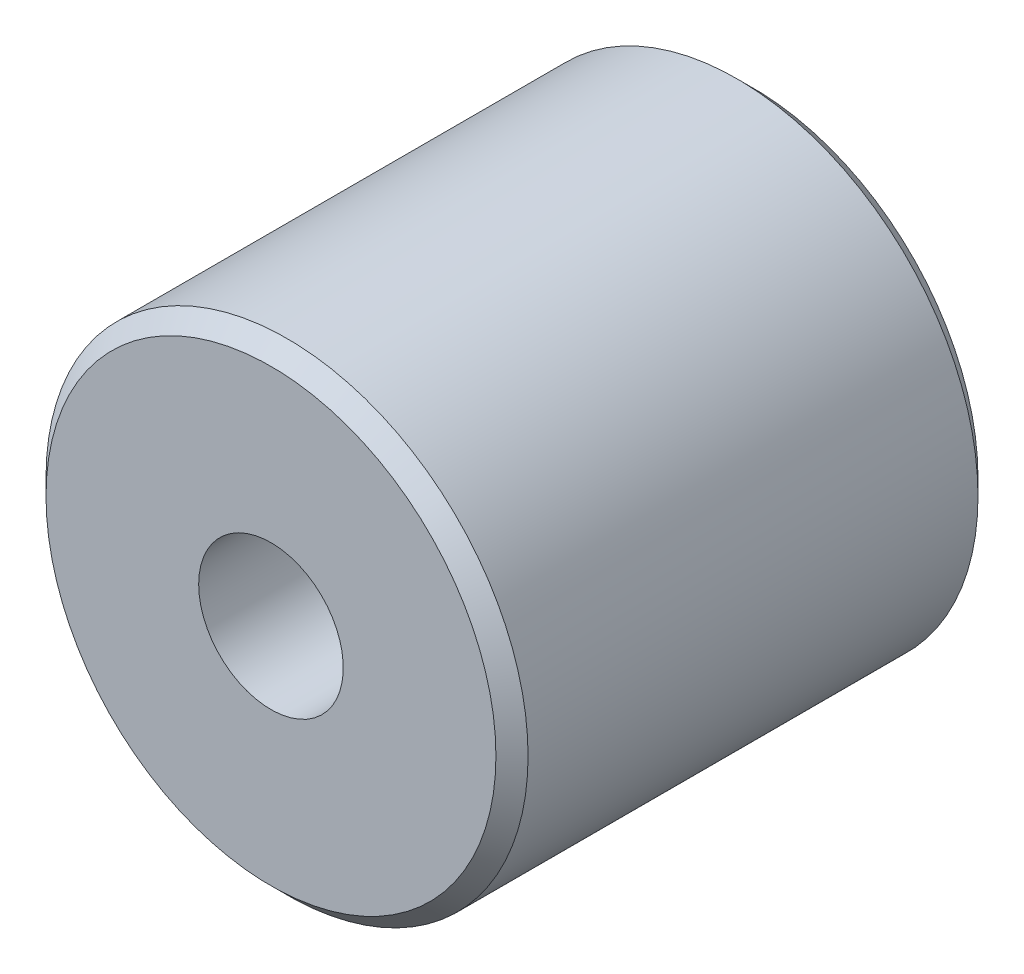
from build123d import *

# Parameters (mm, degrees)
SKETCH_1_W                   = 30
SKETCH_1_H                   = 15
HOLE_WIZARD_M8_1_D           = 9
HOLE_WIZARD_M8_1_CBORE_D     = 15
HOLE_WIZARD_M8_1_CBORE_DEPTH = 8
CHAMFER_1_SIZE               = 1


with BuildPart() as part:
    # 草圖1 → 旋轉1 (revolve)
    with BuildSketch(Plane(origin=(0, 0, 0), x_dir=(0, 0, -1), z_dir=(1, 0, 0)), mode=Mode.PRIVATE) as revolve_1_sk:
        with Locations((15, 7.5)):
            Rectangle(SKETCH_1_W, SKETCH_1_H)
    revolve(revolve_1_sk.sketch.rotate(Axis((0, 0, 2.831513271), (0, 0, -1)), 90), axis=Axis((0, 0, 2.831513271), (0, 0, -1)))

    # M8 六角承窩頭蓋螺釘的柱孔1 (through all)
    with Locations(Plane(origin=(0, 0, -30), x_dir=(-1, 0, 0), z_dir=(0, 0, -1))):
        with Locations((0, 0)):
            CounterBoreHole(HOLE_WIZARD_M8_1_D / 2, HOLE_WIZARD_M8_1_CBORE_D / 2, HOLE_WIZARD_M8_1_CBORE_DEPTH)

    # 導角1
    chamfer_1_edges = [part.edges().sort_by_distance(p)[0] for p in [
        (-15, 0, -30),
        (-15, 0, 0),
    ]]
    chamfer(chamfer_1_edges, length=CHAMFER_1_SIZE)


solid = part.part
